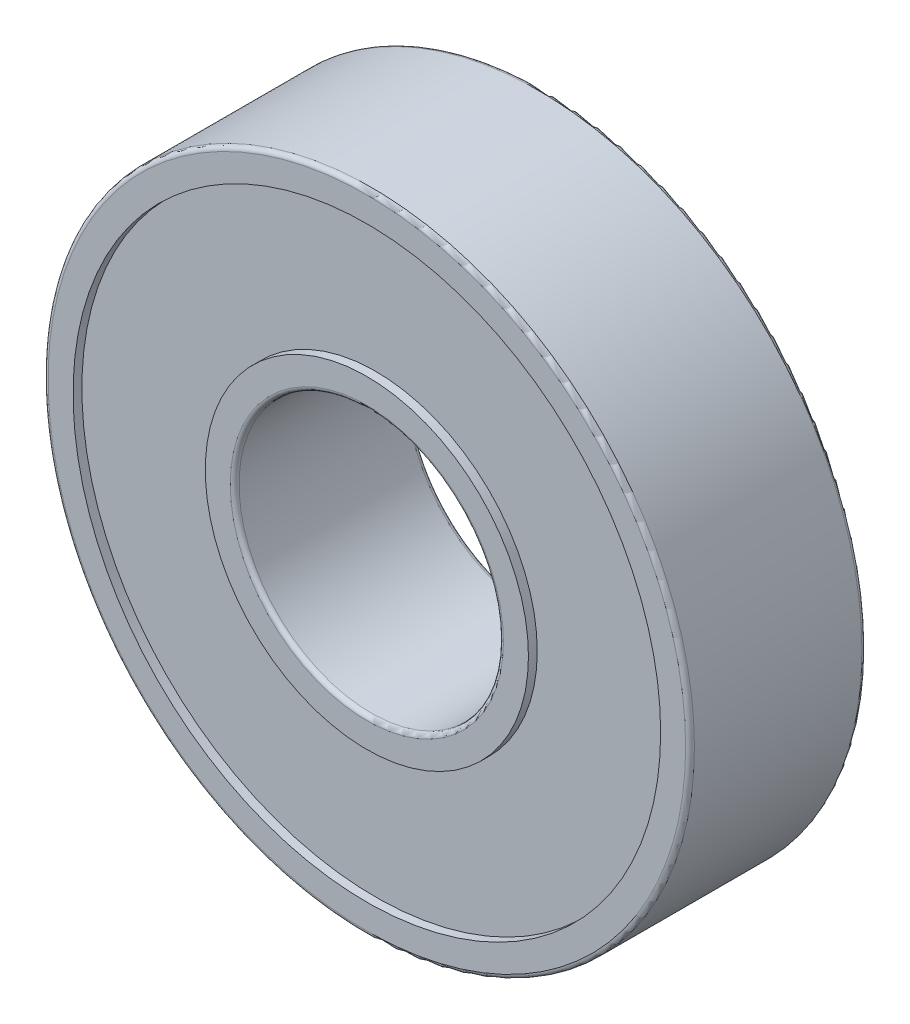
from build123d import *

# Parameters (mm, degrees)
SKETCH1_R           = 11
SKETCH1_R_2         = 4.5
BOSS_EXTRUDE1_DEPTH = 6
SKETCH2_R           = 10
SKETCH2_R_2         = 5.5
CUT_EXTRUDE1_DEPTH  = 0.3
CUT_EXTRUDE2_START  = -5.5
SKETCH2_2_R         = 10
SKETCH2_2_R_2       = 5.5
CUT_EXTRUDE2_DEPTH  = 0.5
FILLET1_R           = 0.15


with BuildPart() as part:
    # Sketch1 → Boss-Extrude1 (new body)
    with BuildSketch(Plane.XY):
        Circle(SKETCH1_R)
        Circle(SKETCH1_R_2, mode=Mode.SUBTRACT)
    extrude(amount=BOSS_EXTRUDE1_DEPTH)

    # Sketch2 → Cut-Extrude1 (cut)
    with BuildSketch(Plane.XY.offset(6)):
        Circle(SKETCH2_R)
        Circle(SKETCH2_R_2, mode=Mode.SUBTRACT)
    extrude(amount=-CUT_EXTRUDE1_DEPTH, mode=Mode.SUBTRACT)

    # Sketch2<2> → Cut-Extrude2 (cut)
    with BuildSketch(Plane.XY.offset(6).offset(CUT_EXTRUDE2_START)):
        Circle(SKETCH2_2_R)
        Circle(SKETCH2_2_R_2, mode=Mode.SUBTRACT)
    extrude(amount=-CUT_EXTRUDE2_DEPTH, mode=Mode.SUBTRACT)

    # Fillet1
    fillet1_edges = [part.edges().sort_by_distance(p)[0] for p in [
        (-11, 0, 0),
        (-11, 0, 6),
        (-4.5, 0, 0),
        (-4.5, 0, 6),
    ]]
    fillet(fillet1_edges, radius=FILLET1_R)


solid = part.part
